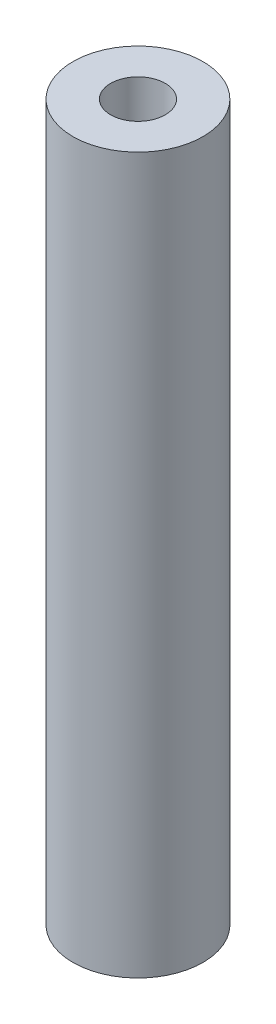
from build123d import *

# Parameters (mm, degrees)
SKETCH1_R           = 6.35
SKETCH1_R_2         = 2.667
BOSS_EXTRUDE1_DEPTH = 69.85


with BuildPart() as part:
    # Sketch1 → Boss-Extrude1 (new body)
    with BuildSketch(Plane(origin=(0, 0, 0), x_dir=(1, 0, 0), z_dir=(0, 1, 0))):
        Circle(SKETCH1_R)
        Circle(SKETCH1_R_2, mode=Mode.SUBTRACT)
    extrude(amount=BOSS_EXTRUDE1_DEPTH)


solid = part.part
